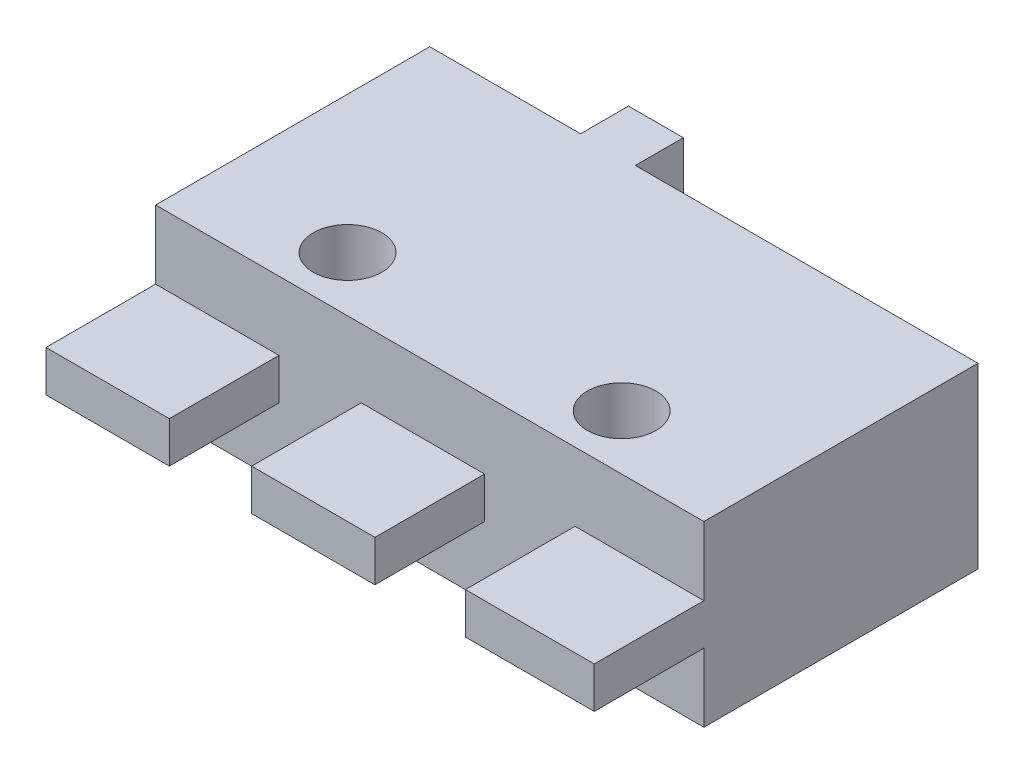
from build123d import *

# Parameters (mm, degrees)
SKETCH1_W           = 20
SKETCH1_H           = 10
BOSS_EXTRUDE1_DEPTH = 6.5
SKETCH2_W           = 20
SKETCH2_H           = 1.5
BOSS_EXTRUDE2_DEPTH = 4
SKETCH3_R           = 1.25
CUT_EXTRUDE1_DEPTH  = 15.941552797
SKETCH4_W           = 2
SKETCH4_H           = 6.5
BOSS_EXTRUDE3_DEPTH = 1.75
SKETCH5_W           = 3
SKETCH5_H           = 4
SKETCH5_W_2         = 3.3
CUT_EXTRUDE2_DEPTH  = 1.75


with BuildPart() as part:
    # Sketch1 → Boss-Extrude1 (new body)
    with BuildSketch(Plane(origin=(0, 0, 0), x_dir=(1, 0, 0), z_dir=(0, 1, 0))):
        Rectangle(SKETCH1_W, SKETCH1_H)
    extrude(amount=BOSS_EXTRUDE1_DEPTH)

    # Sketch2 → Boss-Extrude2 (add)
    with BuildSketch(Plane.XY.offset(5)):
        with Locations((0, 3.25)):
            Rectangle(SKETCH2_W, SKETCH2_H)
    extrude(amount=BOSS_EXTRUDE2_DEPTH)

    # Sketch3 → Cut-Extrude1 (cut, through all)
    with BuildSketch(Plane(origin=(0, 6.5, 0), x_dir=(1, 0, 0), z_dir=(0, 1, 0))):
        with Locations(Location((-5, -3, 0), (0, 0, 270))):
            Circle(SKETCH3_R)
        with Locations(Location((5, -3, 0), (0, 0, 270))):
            Circle(SKETCH3_R)
    extrude(amount=-CUT_EXTRUDE1_DEPTH, mode=Mode.SUBTRACT)

    # Sketch4 → Boss-Extrude3 (add)
    with BuildSketch(Plane(origin=(0, 0, -5), x_dir=(-1, 0, 0), z_dir=(0, 0, -1))):
        with Locations((3.5, 3.25)):
            Rectangle(SKETCH4_W, SKETCH4_H)
    extrude(amount=BOSS_EXTRUDE3_DEPTH)

    # Sketch5 → Cut-Extrude2 (cut)
    with BuildSketch(Plane(origin=(0, 4, 0), x_dir=(1, 0, 0), z_dir=(0, 1, 0))):
        with Locations((-4, -7)):
            Rectangle(SKETCH5_W, SKETCH5_H)
        with Locations((3.65, -7)):
            Rectangle(SKETCH5_W_2, SKETCH5_H)
    extrude(amount=-CUT_EXTRUDE2_DEPTH, mode=Mode.SUBTRACT)


solid = part.part
